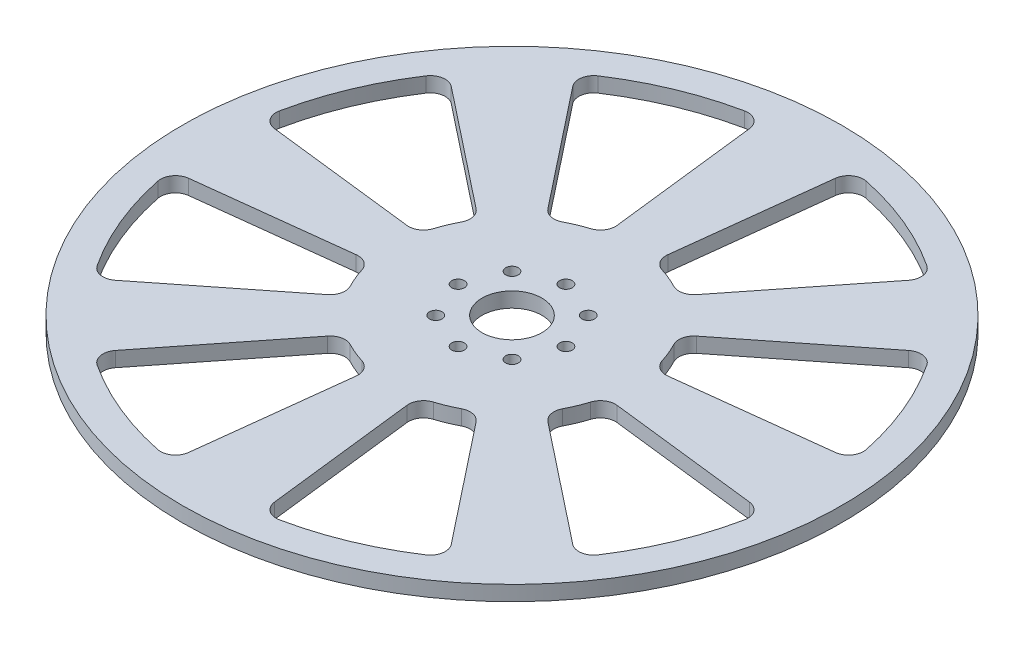
from build123d import *

# Parameters (mm, degrees)
SKETCH_1_R      = 110
SKETCH_1_R_2    = 100
SKETCH_1_R_3    = 40
SKETCH_1_R_4    = 25
SKETCH_1_R_5    = 2.1
SKETCH_1_R_6    = 10
EXTRUDE_3_DEPTH = 5
FILLET_2_R      = 5


with BuildPart() as part:
    # Эскиз1 → Бобышка-Вытянуть3 (new body)
    # profile 1 of 11: a face of its own
    with BuildSketch(Plane(origin=(0, 0, 0), x_dir=(1, 0, 0), z_dir=(0, 1, 0))):
        with Locations(Location((0, 0, 0), (0, 0, 270))):
            Circle(SKETCH_1_R)
        Circle(SKETCH_1_R_2, mode=Mode.SUBTRACT)
    # profile 2 of 11: a face of its own
    with BuildSketch(Plane(origin=(0, 0, 0), x_dir=(1, 0, 0), z_dir=(0, 1, 0))):
        with BuildLine():
            ThreePointArc((-98.875, 14.957753006), (-100, 0), (-98.875, -14.957753006))
            Line((-98.875, -14.957753006), (-39.2, -7.959899497))
            ThreePointArc((-39.2, -7.959899497), (-40, 0), (-39.2, 7.959899497))
            Line((-39.2, 7.959899497), (-98.875, 14.957753006))
        make_face()
    # profile 3 of 11: a face of its own
    with BuildSketch(Plane(origin=(0, 0, 0), x_dir=(1, 0, 0), z_dir=(0, 1, 0))):
        with BuildLine():
            ThreePointArc((-59.338454408, 80.491911572), (-70.710678119, 70.710678119), (-80.491911572, 59.338454408))
            Line((-80.491911572, 59.338454408), (-33.347084734, 22.090086911))
            ThreePointArc((-33.347084734, 22.090086911), (-28.284271247, 28.284271247), (-22.090086911, 33.347084734))
            Line((-22.090086911, 33.347084734), (-59.338454408, 80.491911572))
        make_face()
    # profile 4 of 11: a face of its own
    with BuildSketch(Plane(origin=(0, 0, 0), x_dir=(1, 0, 0), z_dir=(0, 1, 0))):
        with BuildLine():
            ThreePointArc((14.957753006, 98.875), (0, 100), (-14.957753006, 98.875))
            Line((-14.957753006, 98.875), (-7.959899497, 39.2))
            ThreePointArc((-7.959899497, 39.2), (0, 40), (7.959899497, 39.2))
            Line((7.959899497, 39.2), (14.957753006, 98.875))
        make_face()
    # profile 5 of 11: a face of its own
    with BuildSketch(Plane(origin=(0, 0, 0), x_dir=(1, 0, 0), z_dir=(0, 1, 0))):
        with BuildLine():
            Line((33.347084734, 22.090086911), (80.491911572, 59.338454408))
            ThreePointArc((80.491911572, 59.338454408), (70.710678119, 70.710678119), (59.338454408, 80.491911572))
            Line((59.338454408, 80.491911572), (22.090086911, 33.347084734))
            ThreePointArc((22.090086911, 33.347084734), (28.284271247, 28.284271247), (33.347084734, 22.090086911))
        make_face()
    # profile 6 of 11: a face of its own
    with BuildSketch(Plane(origin=(0, 0, 0), x_dir=(1, 0, 0), z_dir=(0, 1, 0))):
        with BuildLine():
            Line((39.2, -7.959899497), (98.875, -14.957753006))
            ThreePointArc((98.875, -14.957753006), (99.718353376, -7.5), (100, 0))
            ThreePointArc((100, 0), (99.718353376, 7.5), (98.875, 14.957753006))
            Line((98.875, 14.957753006), (39.2, 7.959899497))
            ThreePointArc((39.2, 7.959899497), (39.799497484, 4), (40, 0))
            ThreePointArc((40, 0), (39.799497484, -4), (39.2, -7.959899497))
        make_face()
    # profile 7 of 11: a face of its own
    with BuildSketch(Plane(origin=(0, 0, 0), x_dir=(1, 0, 0), z_dir=(0, 1, 0))):
        with BuildLine():
            Line((22.090086911, -33.347084734), (59.338454408, -80.491911572))
            ThreePointArc((59.338454408, -80.491911572), (70.710678119, -70.710678119), (80.491911572, -59.338454408))
            Line((80.491911572, -59.338454408), (33.347084734, -22.090086911))
            ThreePointArc((33.347084734, -22.090086911), (28.284271247, -28.284271247), (22.090086911, -33.347084734))
        make_face()
    # profile 8 of 11: a face of its own
    with BuildSketch(Plane(origin=(0, 0, 0), x_dir=(1, 0, 0), z_dir=(0, 1, 0))):
        with BuildLine():
            Line((-7.959899497, -39.2), (-14.957753006, -98.875))
            ThreePointArc((-14.957753006, -98.875), (0, -100), (14.957753006, -98.875))
            Line((14.957753006, -98.875), (7.959899497, -39.2))
            ThreePointArc((7.959899497, -39.2), (0, -40), (-7.959899497, -39.2))
        make_face()
    # profile 9 of 11: a face of its own
    with BuildSketch(Plane(origin=(0, 0, 0), x_dir=(1, 0, 0), z_dir=(0, 1, 0))):
        with BuildLine():
            ThreePointArc((-80.491911572, -59.338454408), (-70.710678119, -70.710678119), (-59.338454408, -80.491911572))
            Line((-59.338454408, -80.491911572), (-22.090086911, -33.347084734))
            ThreePointArc((-22.090086911, -33.347084734), (-28.284271247, -28.284271247), (-33.347084734, -22.090086911))
            Line((-33.347084734, -22.090086911), (-80.491911572, -59.338454408))
        make_face()
    # profile 10 of 11: a face of its own
    with BuildSketch(Plane(origin=(0, 0, 0), x_dir=(1, 0, 0), z_dir=(0, 1, 0))):
        Circle(SKETCH_1_R_3)
        Circle(SKETCH_1_R_4, mode=Mode.SUBTRACT)
    # profile 11 of 11: a face of its own
    with BuildSketch(Plane(origin=(0, 0, 0), x_dir=(1, 0, 0), z_dir=(0, 1, 0))):
        Circle(SKETCH_1_R_4)
        with Locations(Location((-12.727922061, 12.727922061, 0), (0, 0, 270))):
            Circle(SKETCH_1_R_5, mode=Mode.SUBTRACT)
        with Locations(Location((12.727922061, 12.727922061, 0), (0, 0, 270))):
            Circle(SKETCH_1_R_5, mode=Mode.SUBTRACT)
        with Locations(Location((18, 0, 0), (0, 0, 270))):
            Circle(SKETCH_1_R_5, mode=Mode.SUBTRACT)
        with Locations(Location((-12.727922061, -12.727922061, 0), (0, 0, 270))):
            Circle(SKETCH_1_R_5, mode=Mode.SUBTRACT)
        with Locations(Location((0, -18, 0), (0, 0, 270))):
            Circle(SKETCH_1_R_5, mode=Mode.SUBTRACT)
        with Locations(Location((-18, 0, 0), (0, 0, 270))):
            Circle(SKETCH_1_R_5, mode=Mode.SUBTRACT)
        with Locations(Location((12.727922061, -12.727922061, 0), (0, 0, 270))):
            Circle(SKETCH_1_R_5, mode=Mode.SUBTRACT)
        with Locations(Location((0, 18, 0), (0, 0, 270))):
            Circle(SKETCH_1_R_5, mode=Mode.SUBTRACT)
        with Locations(Location((0, 0, 0), (0, 0, 270))):
            Circle(SKETCH_1_R_6, mode=Mode.SUBTRACT)
    extrude(amount=EXTRUDE_3_DEPTH)

    # Скругление2
    fillet_2_edges = [part.edges().sort_by_distance(p)[0] for p in [
        (59.338454408, 2.5, 80.491911572),
        (22.090086911, 2.5, 33.347084734),
        (7.959899497, 2.5, 39.2),
        (14.957753006, 2.5, 98.875),
        (80.491911572, 2.5, 59.338454408),
        (98.875, 2.5, 14.957753006),
        (39.2, 2.5, 7.959899497),
        (33.347084734, 2.5, 22.090086911),
        (98.875, 2.5, -14.957753006),
        (80.491911572, 2.5, -59.338454408),
        (33.347084734, 2.5, -22.090086911),
        (39.2, 2.5, -7.959899497),
        (59.338454408, 2.5, -80.491911572),
        (14.957753006, 2.5, -98.875),
        (7.959899497, 2.5, -39.2),
        (22.090086911, 2.5, -33.347084734),
        (-14.957753006, 2.5, -98.875),
        (-59.338454408, 2.5, -80.491911572),
        (-22.090086911, 2.5, -33.347084734),
        (-7.959899497, 2.5, -39.2),
        (-80.491911572, 2.5, -59.338454408),
        (-98.875, 2.5, -14.957753006),
        (-39.2, 2.5, -7.959899497),
        (-33.347084734, 2.5, -22.090086911),
        (-98.875, 2.5, 14.957753006),
        (-80.491911572, 2.5, 59.338454408),
        (-33.347084734, 2.5, 22.090086911),
        (-39.2, 2.5, 7.959899497),
        (-59.338454408, 2.5, 80.491911572),
        (-14.957753006, 2.5, 98.875),
        (-7.959899497, 2.5, 39.2),
        (-22.090086911, 2.5, 33.347084734),
    ]]
    fillet(fillet_2_edges, radius=FILLET_2_R)


solid = part.part
